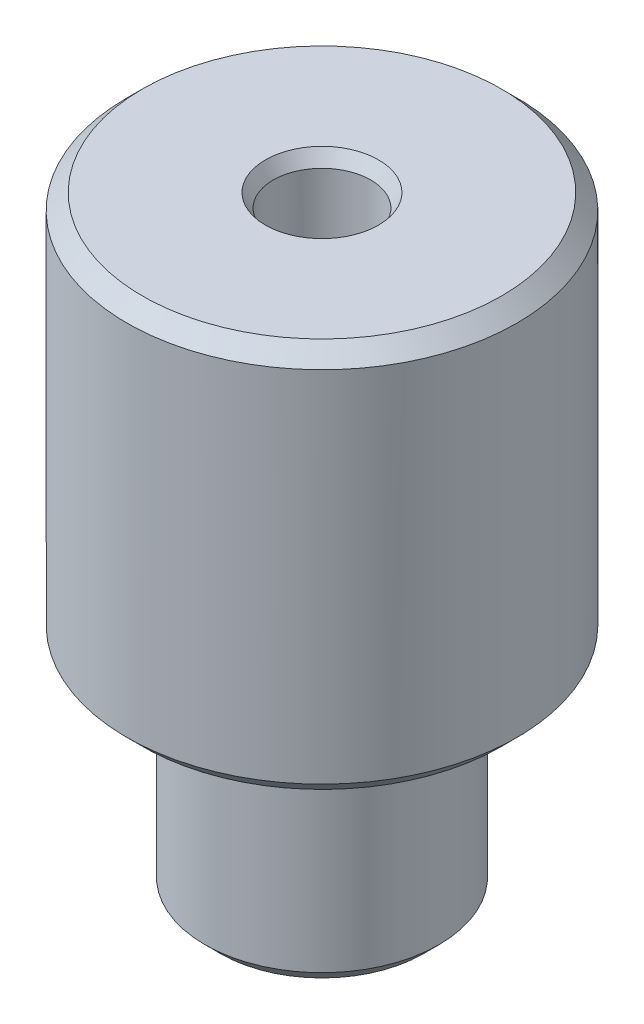
from build123d import *
from OCP.BRepFilletAPI import BRepFilletAPI_MakeChamfer

# Parameters (mm, degrees)
CHAMFER1_SIZE                = 2
F_12_5_12_5_DIAMETER_HOLE1_D = 12.5
CHAMFER2_SIZE                = 1
CHAMFER2_SIZE2               = 1.732050808


with BuildPart() as part:
    # Sketch1 → Revolve1 (revolve)
    with BuildSketch(Plane.XY, mode=Mode.PRIVATE) as revolve1_sk:
        Polygon((0, 0), (25, 0), (25, -50), (15, -50), (15, -78), (0, -78), align=None)
    revolve(revolve1_sk.sketch.rotate(Axis((0, 5, 0), (0, -1, 0)), 180), axis=Axis((0, 5, 0), (0, -1, 0)))

    # Chamfer1
    chamfer1_edges = [part.edges().sort_by_distance(p)[0] for p in [
        (15, -78, 0),
        (25, -50, 0),
        (25, 0, 0),
    ]]
    chamfer(chamfer1_edges, length=CHAMFER1_SIZE)

    # Ø12.5 (12.5) Diameter Hole1 (through all)
    with Locations(Plane(origin=(0, 0, 0), x_dir=(1, 0, 0), z_dir=(0, 1, 0))):
        with Locations((0, 0)):
            Hole(F_12_5_12_5_DIAMETER_HOLE1_D / 2)

    # Chamfer2: one chamfer whose edges measure the first distance from different faces: ONE call of the kernel's chamfer builder (chamfer() names one face for all edges)
    chamfer2_edges_1 = [part.edges().sort_by_distance(p)[0] for p in [
        (6.25, 0, 0),
    ]]
    chamfer2_side_1 = [part.faces().sort_by_distance(p)[0] for p in [
        (22.349461761, 0, 0),
    ]]
    chamfer2_edges_2 = [part.edges().sort_by_distance(p)[0] for p in [
        (6.25, -78, 0),
    ]]
    chamfer2_side_2 = [part.faces().sort_by_distance(p)[0] for p in [
        (12.632304474, -78, 0),
    ]]
    chamfer2 = BRepFilletAPI_MakeChamfer(part.part.solid().wrapped)
    for e in chamfer2_edges_1:
        chamfer2.Add(CHAMFER2_SIZE, CHAMFER2_SIZE2, e.wrapped, chamfer2_side_1[0].wrapped)  # the first distance lies on this face
    for e in chamfer2_edges_2:
        chamfer2.Add(CHAMFER2_SIZE, CHAMFER2_SIZE2, e.wrapped, chamfer2_side_2[0].wrapped)  # the first distance lies on this face
    add(Compound.cast(chamfer2.Shape()), mode=Mode.REPLACE)


solid = part.part
